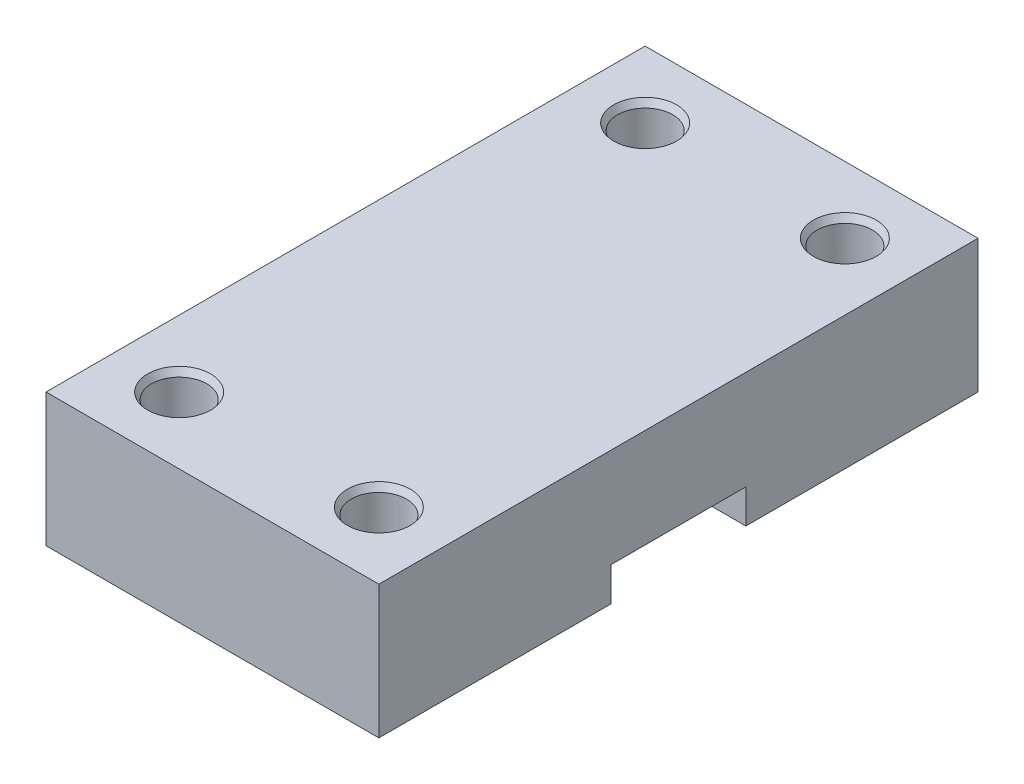
from build123d import *
from OCP.BRepFilletAPI import BRepFilletAPI_MakeChamfer

# Parameters (mm, degrees)
SKETCH1_W               = 50
SKETCH1_H               = 90
BOSS_EXTRUDE1_DEPTH     = 20
CUT_EXTRUDE1_DEPTH      = 71.178344238
CUT_EXTRUDE1_DEPTH_BACK = 71.178344238
SKETCH2_W               = 20.25
SKETCH2_H               = 5.1
SKETCH3_R               = 4.15
CUT_EXTRUDE2_DEPTH      = 56.226805086
CHAMFER1_SIZE           = 1
CHAMFER1_SIZE2          = 0.577350269


with BuildPart() as part:
    # Sketch1 → Boss-Extrude1 (new body)
    with BuildSketch(Plane(origin=(0, 0, 0), x_dir=(1, 0, 0), z_dir=(0, 1, 0))):
        Rectangle(SKETCH1_W, SKETCH1_H)
    extrude(amount=BOSS_EXTRUDE1_DEPTH)

    # Sketch2 → Cut-Extrude1 (cut, two sides: drawn at the far end of the back side and taken through both)
    with BuildSketch(Plane(origin=(25, 0, 0), x_dir=(0, 0, -1), z_dir=(1, 0, 0)).offset(-CUT_EXTRUDE1_DEPTH_BACK)):
        with Locations((0, 2.55)):
            Rectangle(SKETCH2_W, SKETCH2_H)
    extrude(amount=CUT_EXTRUDE1_DEPTH + CUT_EXTRUDE1_DEPTH_BACK, mode=Mode.SUBTRACT)

    # Sketch3 → Cut-Extrude2 (cut, through all)
    with BuildSketch(Plane.XZ):
        with Locations(Location((-15, 35, 0), (0, 0, 270))):
            Circle(SKETCH3_R)
        with Locations(Location((-15, -35, 0), (0, 0, 270))):
            Circle(SKETCH3_R)
        with Locations(Location((15, 35, 0), (0, 0, 270))):
            Circle(SKETCH3_R)
        with Locations(Location((15, -35, 0), (0, 0, 270))):
            Circle(SKETCH3_R)
    extrude(amount=-CUT_EXTRUDE2_DEPTH, mode=Mode.SUBTRACT)

    # Chamfer1: one chamfer whose edges measure the first distance from different faces: ONE call of the kernel's chamfer builder (chamfer() names one face for all edges)
    chamfer1_edges_1 = [part.edges().sort_by_distance(p)[0] for p in [
        (-15, 20, 39.15),
    ]]
    chamfer1_side_1 = [part.faces().sort_by_distance(p)[0] for p in [
        (-15, 10, 39.15),
    ]]
    chamfer1_edges_2 = [part.edges().sort_by_distance(p)[0] for p in [
        (15, 20, 39.15),
    ]]
    chamfer1_side_2 = [part.faces().sort_by_distance(p)[0] for p in [
        (15, 10, 39.15),
    ]]
    chamfer1_edges_3 = [part.edges().sort_by_distance(p)[0] for p in [
        (15, 20, -30.85),
    ]]
    chamfer1_side_3 = [part.faces().sort_by_distance(p)[0] for p in [
        (15, 10, -30.85),
    ]]
    chamfer1_edges_4 = [part.edges().sort_by_distance(p)[0] for p in [
        (-15, 20, -30.85),
    ]]
    chamfer1_side_4 = [part.faces().sort_by_distance(p)[0] for p in [
        (-15, 10, -30.85),
    ]]
    chamfer1 = BRepFilletAPI_MakeChamfer(part.part.solid().wrapped)
    for e in chamfer1_edges_1:
        chamfer1.Add(CHAMFER1_SIZE, CHAMFER1_SIZE2, e.wrapped, chamfer1_side_1[0].wrapped)  # the first distance lies on this face
    for e in chamfer1_edges_2:
        chamfer1.Add(CHAMFER1_SIZE, CHAMFER1_SIZE2, e.wrapped, chamfer1_side_2[0].wrapped)  # the first distance lies on this face
    for e in chamfer1_edges_3:
        chamfer1.Add(CHAMFER1_SIZE, CHAMFER1_SIZE2, e.wrapped, chamfer1_side_3[0].wrapped)  # the first distance lies on this face
    for e in chamfer1_edges_4:
        chamfer1.Add(CHAMFER1_SIZE, CHAMFER1_SIZE2, e.wrapped, chamfer1_side_4[0].wrapped)  # the first distance lies on this face
    add(Compound.cast(chamfer1.Shape()), mode=Mode.REPLACE)


solid = part.part
